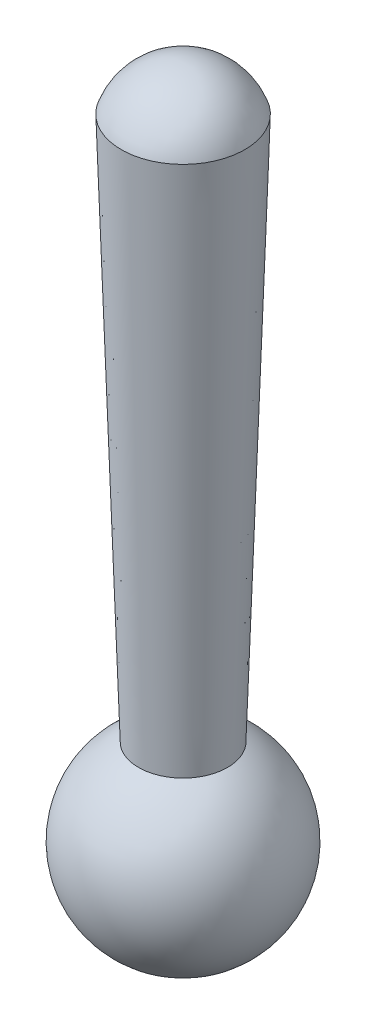
from build123d import *


with BuildPart() as part:
    # Sketch1 → Revolve1 (revolve)
    with BuildSketch(Plane.XY):
        with BuildLine():
            Line((-1.25, 12.741149046), (-0.9, 1.741149046))
            ThreePointArc((-0.9, 1.741149046), (-1.904501527, -0.463113307), (0, -1.96))
            Line((0, -1.96), (0, 13.639556939))
            ThreePointArc((0, 13.639556939), (-0.769681223, 13.391655241), (-1.25, 12.741149046))
        make_face()
    revolve(axis=Axis((0, 1.96, 0), (0, 1, 0)))


solid = part.part
